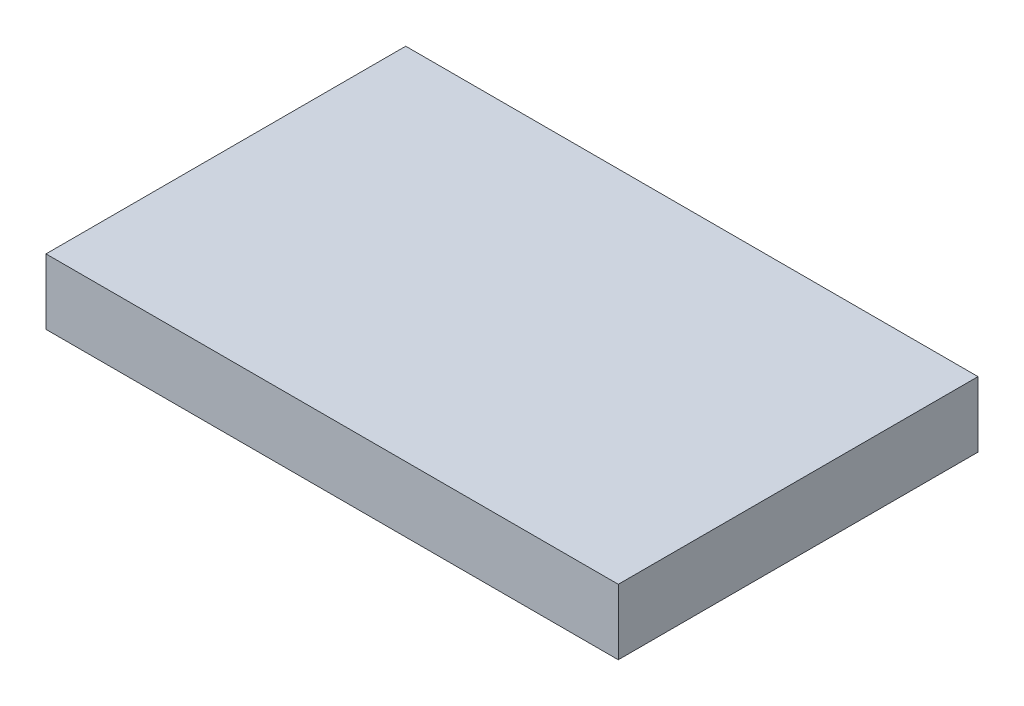
from build123d import *

# Parameters (mm, degrees)
SKETCH1_W           = 55.5625
SKETCH1_H           = 34.925
BOSS_EXTRUDE1_DEPTH = 6.35


with BuildPart() as part:
    # Sketch1 → Boss-Extrude1 (new body)
    with BuildSketch(Plane(origin=(0, 0, 0), x_dir=(1, 0, 0), z_dir=(0, 1, 0))):
        with Locations((27.78125, 17.4625)):
            Rectangle(SKETCH1_W, SKETCH1_H)
    extrude(amount=BOSS_EXTRUDE1_DEPTH)


solid = part.part
